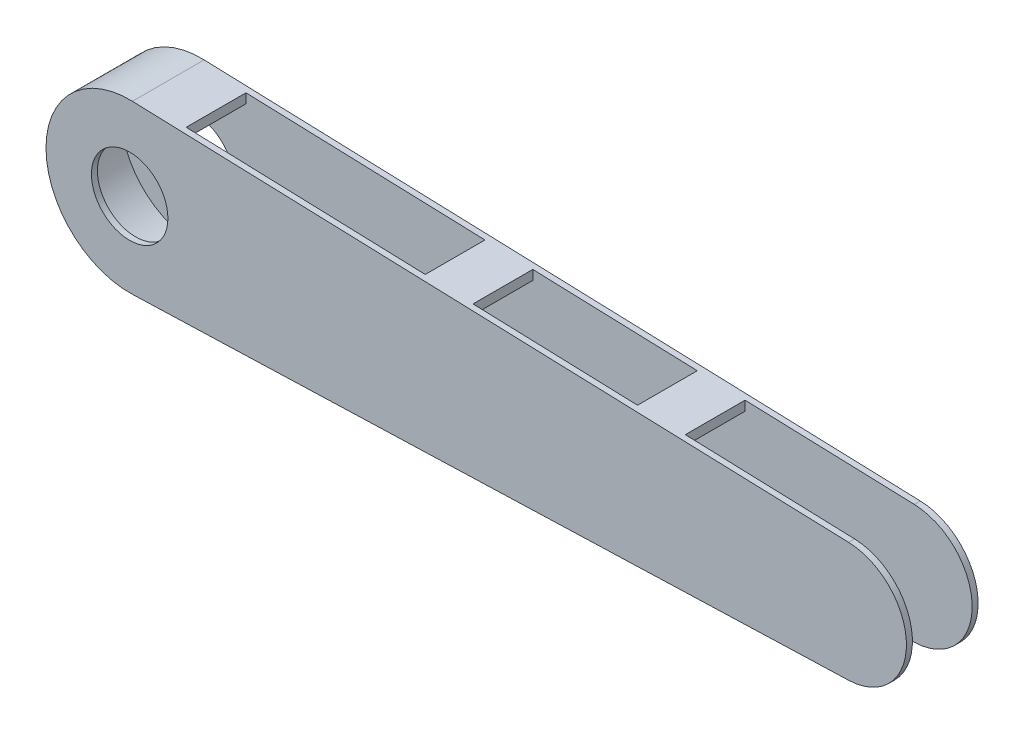
from build123d import *

# Parameters (mm, degrees)
EXTRUDE_1_DEPTH          = 15
CUT_EXTRUDE_1_DEPTH      = 328.223165439
CUT_EXTRUDE_1_DEPTH_BACK = 328.223165439
SKETCH_3_R               = 16
CUT_EXTRUDE_2_DEPTH      = 12.5


with BuildPart() as part:
    # Эскиз1 → Бобышка-Вытянуть1 (new, symmetric)
    with BuildSketch(Plane.XY):
        with BuildLine():
            Line((1.166666667, 34.980550151), (300.833333333, 24.986107251))
            ThreePointArc((300.833333333, 24.986107251), (325, 0), (300.833333333, -24.986107251))
            Line((300.833333333, -24.986107251), (1.166666667, -34.980550151))
            ThreePointArc((1.166666667, -34.980550151), (-35, 0), (1.166666667, 34.980550151))
        make_face()
    extrude(amount=EXTRUDE_1_DEPTH, both=True)

    # Эскиз3 → Вырез-Вытянуть1 (cut, two sides: drawn at the far end of the back side and taken through both)
    with BuildSketch(Plane.XY.offset(-CUT_EXTRUDE_1_DEPTH_BACK)):
        Circle(SKETCH_3_R)
    extrude(amount=CUT_EXTRUDE_1_DEPTH + CUT_EXTRUDE_1_DEPTH_BACK, mode=Mode.SUBTRACT)

    # Эскиз4 → Вырез-Вытянуть2 (cut, symmetric)
    with BuildSketch(Plane.XY):
        with BuildLine():
            Line((230, 23.346307109), (210, 24.013344455))
            Line((210, 24.013344455), (210, 28.015568531))
            Line((210, 28.015568531), (141.166666667, 30.31128873))
            Line((141.166666667, 30.31128873), (141.166666667, 26.309064654))
            Line((141.166666667, 26.309064654), (121.166666667, 26.976102))
            Line((121.166666667, 26.976102), (121.166666667, 30.978326076))
            Line((121.166666667, 30.978326076), (21.166666667, 34.313512805))
            Line((21.166666667, 34.313512805), (21.166666667, 30.31128873))
            Line((21.166666667, 30.31128873), (1.033333333, 30.982772991))
            ThreePointArc((1.033333333, 30.982772991), (-31, 0), (1.033333333, -30.982772991))
            Line((1.033333333, -30.982772991), (21.166666667, -30.31128873))
            Line((21.166666667, -30.31128873), (21.166666667, -34.313512805))
            Line((21.166666667, -34.313512805), (121.166666667, -30.978326076))
            Line((121.166666667, -30.978326076), (121.166666667, -26.976102))
            Line((121.166666667, -26.976102), (141.166666667, -26.309064654))
            Line((141.166666667, -26.309064654), (141.166666667, -30.31128873))
            Line((141.166666667, -30.31128873), (210, -28.015568531))
            Line((210, -28.015568531), (210, -24.013344455))
            Line((210, -24.013344455), (230, -23.346307109))
            Line((230, -23.346307109), (230, -27.348531185))
            Line((230, -27.348531185), (300.833333333, -24.986107251))
            ThreePointArc((300.833333333, -24.986107251), (325, 0), (300.833333333, 24.986107251))
            Line((300.833333333, 24.986107251), (230, 27.348531185))
            Line((230, 27.348531185), (230, 23.346307109))
        make_face()
    extrude(amount=CUT_EXTRUDE_2_DEPTH, both=True, mode=Mode.SUBTRACT)


solid = part.part
